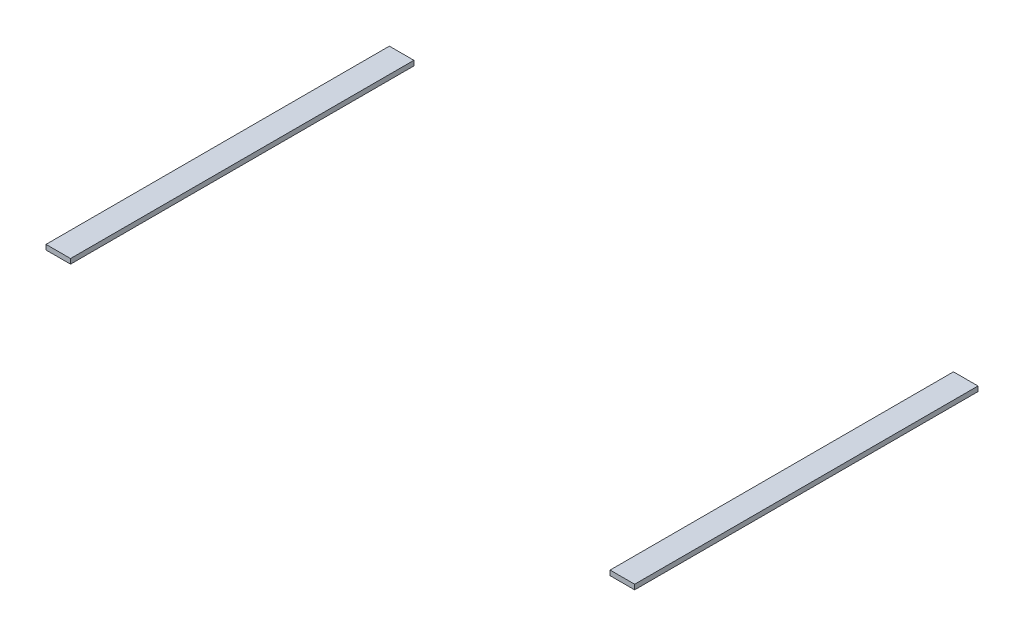
from build123d import *

# Parameters (mm, degrees)
SKETCH1_W           = 240
SKETCH1_H           = 140
BOSS_EXTRUDE1_DEPTH = 2
SKETCH2_W           = 220
SKETCH2_H           = 140
CUT_EXTRUDE1_DEPTH  = 2


with BuildPart() as part:
    # Sketch1 → Boss-Extrude1 (new body)
    with BuildSketch(Plane(origin=(0, 0, 0), x_dir=(1, 0, 0), z_dir=(0, 1, 0))):
        Rectangle(SKETCH1_W, SKETCH1_H)
    extrude(amount=BOSS_EXTRUDE1_DEPTH)

    # Sketch2 → Cut-Extrude1 (cut)
    with BuildSketch(Plane(origin=(0, 0, 0), x_dir=(1, 0, 0), z_dir=(0, 1, 0))):
        Rectangle(SKETCH2_W, SKETCH2_H)
    extrude(amount=CUT_EXTRUDE1_DEPTH, mode=Mode.SUBTRACT)


with BuildPart() as cut_extrude1_piece_1:
    # of the separate pieces the step leaves, piece 1, a body of its own (cut_extrude1_pieces)
    add(part.part.solids().sort_by_distance((-110, 0, 70))[0])


with BuildPart() as cut_extrude1_piece_2:
    # of the separate pieces the step leaves, piece 2, a body of its own (cut_extrude1_pieces)
    add(part.part.solids().sort_by_distance((120, 0, 70))[0])


solid = Compound([cut_extrude1_piece_1.part, cut_extrude1_piece_2.part])
